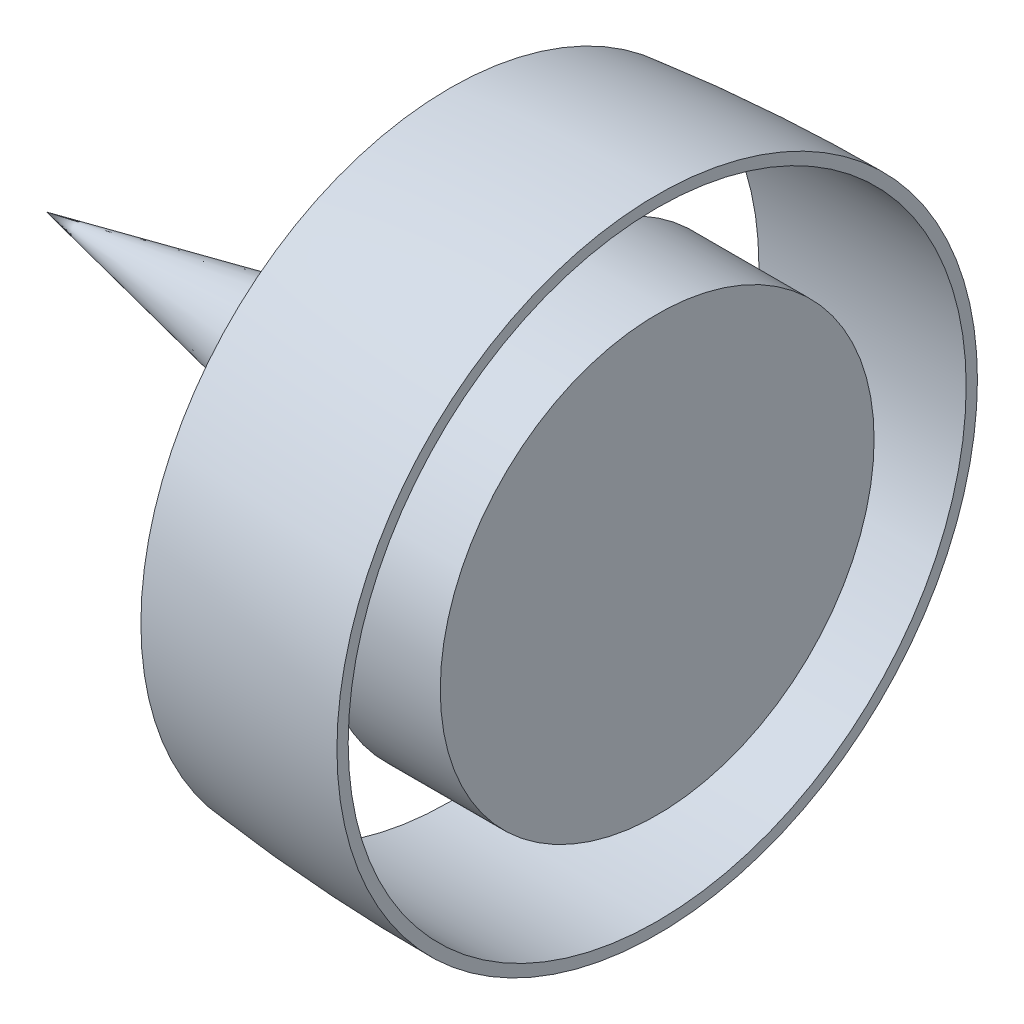
from build123d import *


with BuildPart() as part:
    # Schizzo1 → Rivoluzione1 (revolve)
    with BuildSketch(Plane.XY, mode=Mode.PRIVATE) as rivoluzione1_sk:
        Polygon((436.837862623, 91.260184196), (0, 0), (1085.872559264, 0), (1085.872559264, 385.761420338), (874.852884773, 385.761420338), (706.922290359, 224.158198439), align=None)
        with BuildLine():
            ThreePointArc((1085.872559264, 569.520350938), (901.297260731, 564.516676415), (717.264144663, 549.520350938))
            Line((717.264144663, 549.520350938), (1085.872559264, 549.520350938))
            Line((1085.872559264, 549.520350938), (1085.872559264, 569.520350938))
        make_face()
    revolve(rivoluzione1_sk.sketch.rotate(Axis((-275.018458385, 0, 0), (1, 0, 0)), 90), axis=Axis((-275.018458385, 0, 0), (1, 0, 0)))


solid = part.part
